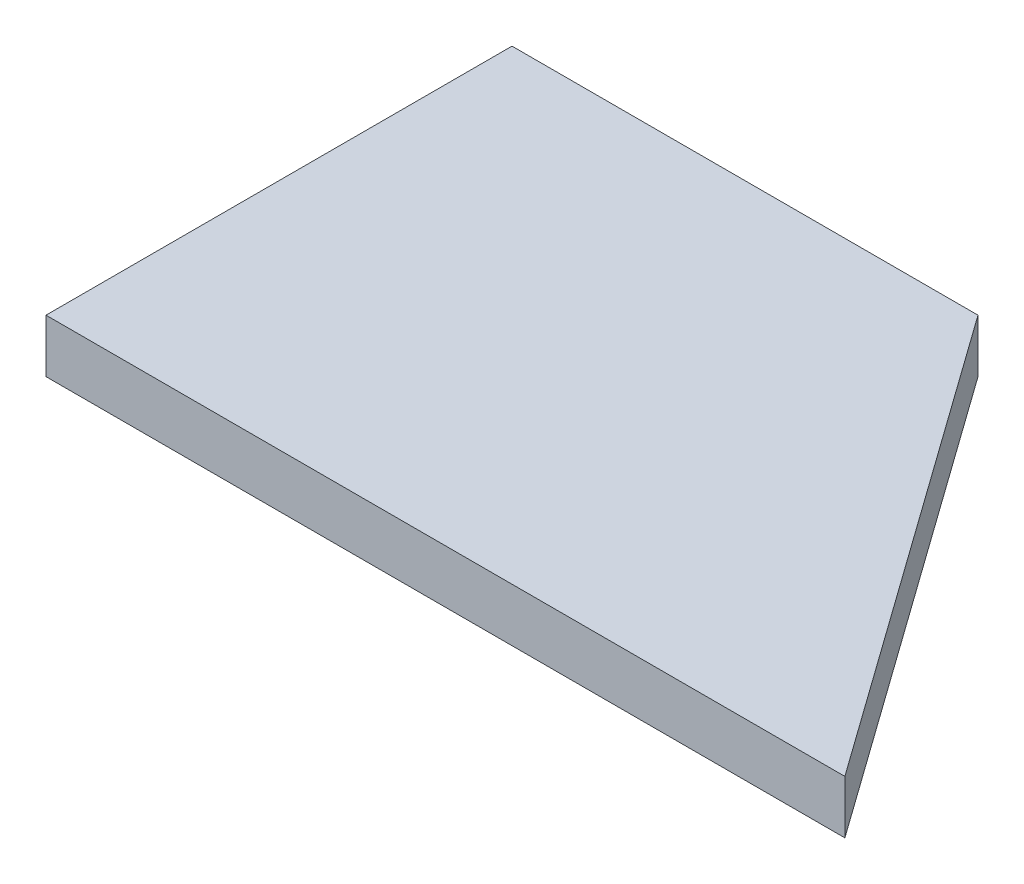
from build123d import *

# Parameters (mm, degrees)
BOSS_EXTRUDE1_DEPTH = 8


with BuildPart() as part:
    # Sketch1 → Boss-Extrude1 (new body)
    with BuildSketch(Plane(origin=(0, 0, 0), x_dir=(1, 0, 0), z_dir=(0, 1, 0))):
        Polygon((0, 0), (120, 0), (70, 70), (0, 70), align=None)
    extrude(amount=BOSS_EXTRUDE1_DEPTH)


solid = part.part
